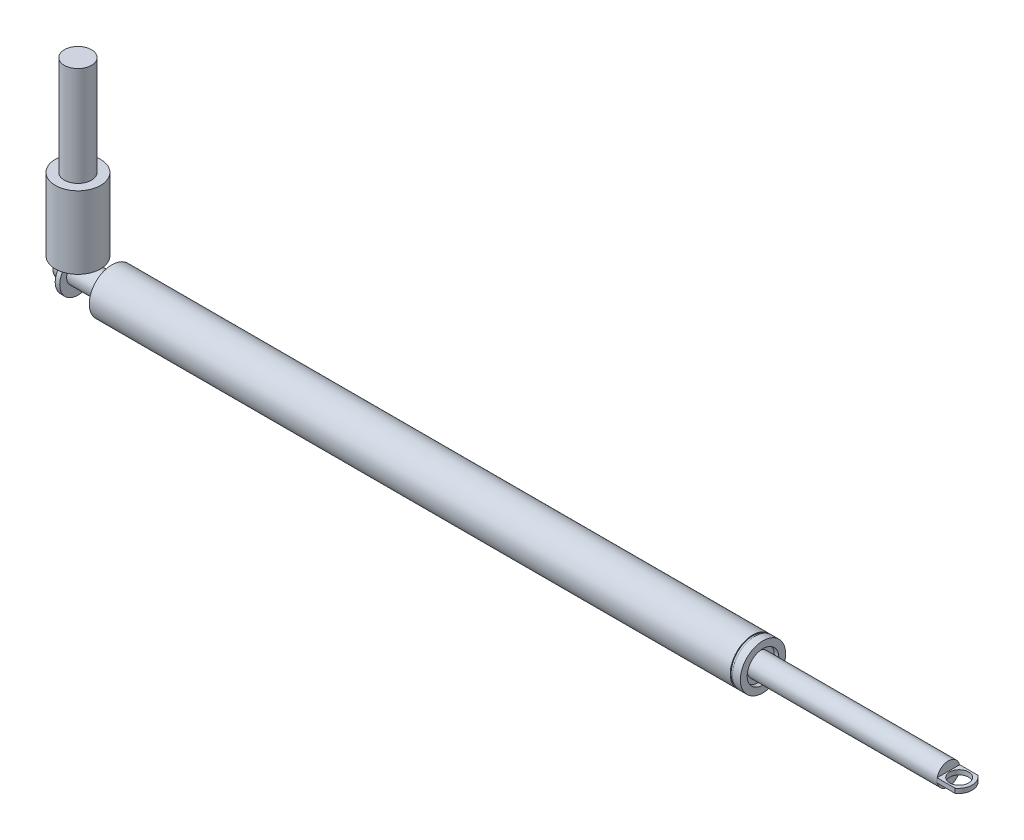
from build123d import *

# Parameters (mm, degrees)
SKETCH_2_R          = 2.5
EXTRUDE_2_DEPTH     = 7.5
SKETCH_10_R         = 3
EXTRUDE_3_DEPTH     = 15
SKETCH_11_R         = 5
EXTRUDE_4_DEPTH     = 16
SKETCH_12_W         = 1
SKETCH_12_H         = 5
EXTRUDE_6_DEPTH     = 0.4
EXTRUDE_7_DEPTH     = 1
SKETCH_14_R         = 2.5
EXTRUDE_10_DEPTH    = 2
EXTRUDE_START       = 2
SKETCH_21_R         = 3
EXTRUDE_14_DEPTH    = 2
SKETCH_25_R         = 5
EXTRUDE_16_DEPTH    = 144
SKETCH_26_R         = 3.5
CUT_EXTRUDE_3_DEPTH = 1
SKETCH_27_R         = 2.5
EXTRUDE_17_DEPTH    = 42
EXTRUDE_18_DEPTH    = 0.5
SKETCH_19_R         = 2.103210471
CUT_EXTRUDE_4_DEPTH = 0.5
EXTRUDE_START_2     = 3
SKETCH_31_R         = 3
EXTRUDE_19_DEPTH    = 3
SKETCH_32_R         = 3
EXTRUDE_20_DEPTH    = 2
SKETCH_33_OUTSIDE_W = 53.63
SKETCH_33_OUTSIDE_H = 89.578
SKETCH_33_OUTSIDE_R = 4.8
CUT_EXTRUDE_6_DEPTH = 0.25


with BuildPart() as part:
    # 草图2 → 凸台-拉伸2 (new body)
    with BuildSketch(Plane(origin=(0, 0, 0), x_dir=(0, 0, -1), z_dir=(1, 0, 0))):
        with Locations((0, 12.052457573)):
            Circle(SKETCH_2_R)
    extrude(amount=EXTRUDE_2_DEPTH)



with BuildPart() as body_2:
    # 草图10 → 凸台-拉伸3 (new body)
    with BuildSketch(Plane(origin=(0, 45.94754243, 0), x_dir=(1, 0, 0), z_dir=(0, 1, 0))):
        with Locations(Location((0, 0, 0), (0, 0, 270))):
            Circle(SKETCH_10_R)
    extrude(amount=-EXTRUDE_3_DEPTH)

    # 草图11 → 凸台-拉伸4 (add)
    with BuildSketch(Plane(origin=(0, 30.94754243, 0), x_dir=(1, 0, 0), z_dir=(0, 1, 0))):
        with Locations(Location((0, 0, 0), (0, 0, 270))):
            Circle(SKETCH_11_R)
    extrude(amount=-EXTRUDE_4_DEPTH)


with BuildPart() as part_1:
    add(part.part)

    add(body_2.part)  # 凸台-拉伸6 merges body 2
    # 草图12 → 凸台-拉伸6 (add)
    with BuildSketch(Plane.XZ.offset(-14.94754243)):
        with Locations((-0.5, 0.028858947)):
            Rectangle(SKETCH_12_W, SKETCH_12_H)
    extrude(amount=EXTRUDE_6_DEPTH)

    # 草图13 → 凸台-拉伸7 (add)
    with BuildSketch(Plane(origin=(0, 0, 0), x_dir=(0, 0, -1), z_dir=(1, 0, 0))):
        with BuildLine():
            Line((-2.528858947, 14.54754243), (2.471141053, 14.54754243))
            ThreePointArc((2.471141053, 14.54754243), (-0.028858947, 7.425043431), (-2.528858947, 14.54754243))
        make_face()
    extrude(amount=-EXTRUDE_7_DEPTH)

    # 草图14 → 凸台-拉伸10 (add)
    with BuildSketch(Plane.ZY.offset(1)):
        with Locations(Location((0.028858947, 12.04754243, 0), (0, 0, 180))):
            Circle(SKETCH_14_R)
    extrude(amount=EXTRUDE_10_DEPTH)

    # 草图21 → 凸台-拉伸14 (add)
    with BuildSketch(Plane(origin=(0, 45.94754243, 0), x_dir=(1, 0, 0), z_dir=(0, 1, 0)).offset(EXTRUDE_START)):
        with Locations(Location((0, 0, 0), (0, 0, 270))):
            Circle(SKETCH_21_R)
    extrude(amount=-EXTRUDE_14_DEPTH)

    # 草图25 → 凸台-拉伸16 (add)
    with BuildSketch(Plane(origin=(7.5, 0, 0), x_dir=(0, 0, -1), z_dir=(1, 0, 0))):
        with Locations((0, 12)):
            Circle(SKETCH_25_R)
    extrude(amount=EXTRUDE_16_DEPTH)

    # 草图26 → 切除-拉伸3 (cut)
    with BuildSketch(Plane(origin=(151.5, 0, 0), x_dir=(0, 0, -1), z_dir=(1, 0, 0))):
        with Locations((0, 12)):
            Circle(SKETCH_26_R)
    extrude(amount=-CUT_EXTRUDE_3_DEPTH, mode=Mode.SUBTRACT)

    # 草图27 → 凸台-拉伸17 (add)
    with BuildSketch(Plane(origin=(150.5, 0, 0), x_dir=(0, 0, -1), z_dir=(1, 0, 0))):
        with Locations((0, 12)):
            Circle(SKETCH_27_R)
    extrude(amount=EXTRUDE_17_DEPTH)

    # 草图30 → 凸台-拉伸18 (add, symmetric)
    with BuildSketch(Plane(origin=(0, 12, 0), x_dir=(1, 0, 0), z_dir=(0, 1, 0))):
        with BuildLine():
            Line((192.5, 2.5), (196.5, 2.5))
            ThreePointArc((196.5, 2.5), (197.767182761, 0), (196.5, -2.5))
            Line((196.5, -2.5), (192.5, -2.5))
            Line((192.5, -2.5), (192.5, 2.5))
        make_face()
    extrude(amount=EXTRUDE_18_DEPTH, both=True)

    # 草图19 → 切除-拉伸4 (cut, symmetric)
    with BuildSketch(Plane(origin=(0, 12, 0), x_dir=(1, 0, 0), z_dir=(0, 1, 0))):
        with Locations(Location((194.882176, 0, 0), (0, 0, 270))):
            Circle(SKETCH_19_R)
    extrude(amount=CUT_EXTRUDE_4_DEPTH, both=True, mode=Mode.SUBTRACT)

    # 草图31 → 凸台-拉伸19 (add)
    with BuildSketch(Plane(origin=(0, 47.94754243, 0), x_dir=(1, 0, 0), z_dir=(0, 1, 0)).offset(EXTRUDE_START_2)):
        with Locations(Location((0, 0, 0), (0, 0, 270))):
            Circle(SKETCH_31_R)
    extrude(amount=-EXTRUDE_19_DEPTH)

    # 草图32 → 凸台-拉伸20 (add)
    with BuildSketch(Plane(origin=(0, 50.94754243, 0), x_dir=(1, 0, 0), z_dir=(0, 1, 0)).offset(EXTRUDE_START)):
        with Locations(Location((0, 0, 0), (0, 0, 270))):
            Circle(SKETCH_32_R)
    extrude(amount=-EXTRUDE_20_DEPTH)

    # 草图33 outside → 切除-拉伸6 (cut, symmetric)
    with BuildSketch(Plane(origin=(149.5, 0, 0), x_dir=(0, 0, -1), z_dir=(1, 0, 0))):
        with Locations((0, 29.974)):
            Rectangle(SKETCH_33_OUTSIDE_W, SKETCH_33_OUTSIDE_H)
        with Locations((0, 12)):
            Circle(SKETCH_33_OUTSIDE_R, mode=Mode.SUBTRACT)
    extrude(amount=CUT_EXTRUDE_6_DEPTH, both=True, mode=Mode.SUBTRACT)


solid = part_1.part
